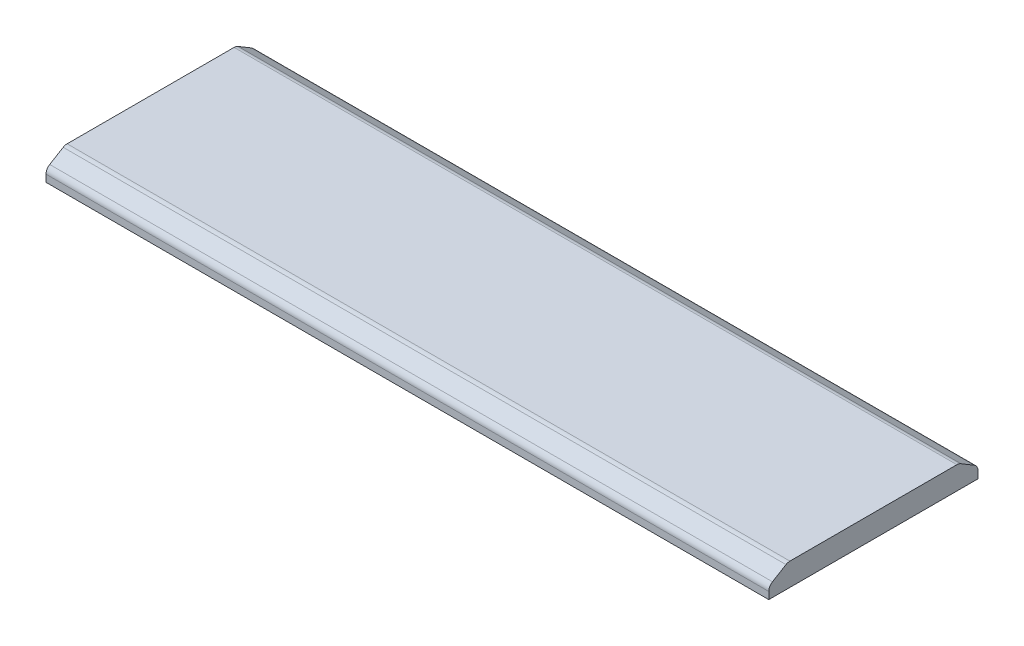
from build123d import *

# Parameters (mm, degrees)
BOSS_EXTRUDE1_DEPTH = 190
FILLET1_R           = 2
SKETCH2_W           = 4
SKETCH2_H           = 3
BOSS_EXTRUDE2_DEPTH = 2
SKETCH3_W           = 4
SKETCH3_H           = 5
BOSS_EXTRUDE3_DEPTH = 3
CUT_EXTRUDE2_DEPTH  = 193.294695715
FILLET2_R           = 1
FILLET3_R           = 1


with BuildPart() as part:
    # Sketch1 → Boss-Extrude1 (new body)
    with BuildSketch(Plane(origin=(0, 0, 0), x_dir=(0, 0, -1), z_dir=(1, 0, 0))):
        Polygon((-22.5, 0), (22.5, 0), (27.5, -3), (27.5, -6), (-27.5, -6), (-27.5, -3), align=None)
    extrude(amount=BOSS_EXTRUDE1_DEPTH)

    # Fillet1
    fillet1_edges = [part.edges().sort_by_distance(p)[0] for p in [
        (95, 0, 22.5),
        (95, 0, -22.5),
        (95, -3, -27.5),
        (95, -3, 27.5),
    ]]
    fillet(fillet1_edges, radius=FILLET1_R)

    # Sketch2 → Boss-Extrude2 (add)
    with BuildSketch(Plane.XZ.offset(6)):
        with Locations((32, -21)):
            Rectangle(SKETCH2_W, SKETCH2_H)
        with Locations((32, 21)):
            Rectangle(SKETCH2_W, SKETCH2_H)
        with Locations((66, -21)):
            Rectangle(SKETCH2_W, SKETCH2_H)
        with Locations((66, 21)):
            Rectangle(SKETCH2_W, SKETCH2_H)
        with Locations((158, -21)):
            Rectangle(SKETCH2_W, SKETCH2_H)
        with Locations((124, -21)):
            Rectangle(SKETCH2_W, SKETCH2_H)
        with Locations((124, 21)):
            Rectangle(SKETCH2_W, SKETCH2_H)
        with Locations((158, 21)):
            Rectangle(SKETCH2_W, SKETCH2_H)
    extrude(amount=BOSS_EXTRUDE2_DEPTH)

    # Sketch3 → Boss-Extrude3 (add)
    with BuildSketch(Plane.XZ.offset(8)):
        with Locations((32, -22)):
            Rectangle(SKETCH3_W, SKETCH3_H)
        with Locations((32, 22)):
            Rectangle(SKETCH3_W, SKETCH3_H)
        with Locations((66, -22)):
            Rectangle(SKETCH3_W, SKETCH3_H)
        with Locations((66, 22)):
            Rectangle(SKETCH3_W, SKETCH3_H)
        with Locations((158, -22)):
            Rectangle(SKETCH3_W, SKETCH3_H)
        with Locations((124, -22)):
            Rectangle(SKETCH3_W, SKETCH3_H)
        with Locations((124, 22)):
            Rectangle(SKETCH3_W, SKETCH3_H)
        with Locations((158, 22)):
            Rectangle(SKETCH3_W, SKETCH3_H)
    extrude(amount=BOSS_EXTRUDE3_DEPTH)

    # Sketch4 → Cut-Extrude2 (cut, through all)
    with BuildSketch(Plane.ZY):
        Polygon((-24.5, -8), (-21.3, -11), (-24.5, -11), align=None)
        Polygon((24.5, -8), (21.3, -11), (24.5, -11), align=None)
    extrude(amount=-CUT_EXTRUDE2_DEPTH, mode=Mode.SUBTRACT)

    # Fillet2
    fillet2_edges = [part.edges().sort_by_distance(p)[0] for p in [
        (32, -11, -19.5),
        (32, -11, 19.5),
        (66, -11, -19.5),
        (66, -11, 19.5),
        (158, -11, -19.5),
        (124, -11, -19.5),
        (124, -11, 19.5),
        (158, -11, 19.5),
    ]]
    fillet(fillet2_edges, radius=FILLET2_R)

    # Fillet3
    fillet3_edges = [part.edges().sort_by_distance(p)[0] for p in [
        (124, -6, -19.5),
        (122, -6, -21),
        (126, -6, -21),
        (122, -6, 21),
        (124, -6, 19.5),
        (126, -6, 21),
        (158, -6, 19.5),
        (160, -6, 21),
        (156, -6, 21),
        (30, -6, -21),
        (34, -6, -21),
        (32, -6, -19.5),
        (30, -6, 21),
        (32, -6, 19.5),
        (34, -6, 21),
        (68, -6, -21),
        (66, -6, -19.5),
        (64, -6, -21),
        (66, -6, 19.5),
        (68, -6, 21),
        (64, -6, 21),
        (160, -6, -21),
        (158, -6, -19.5),
        (156, -6, -21),
    ]]
    fillet(fillet3_edges, radius=FILLET3_R)


solid = part.part
